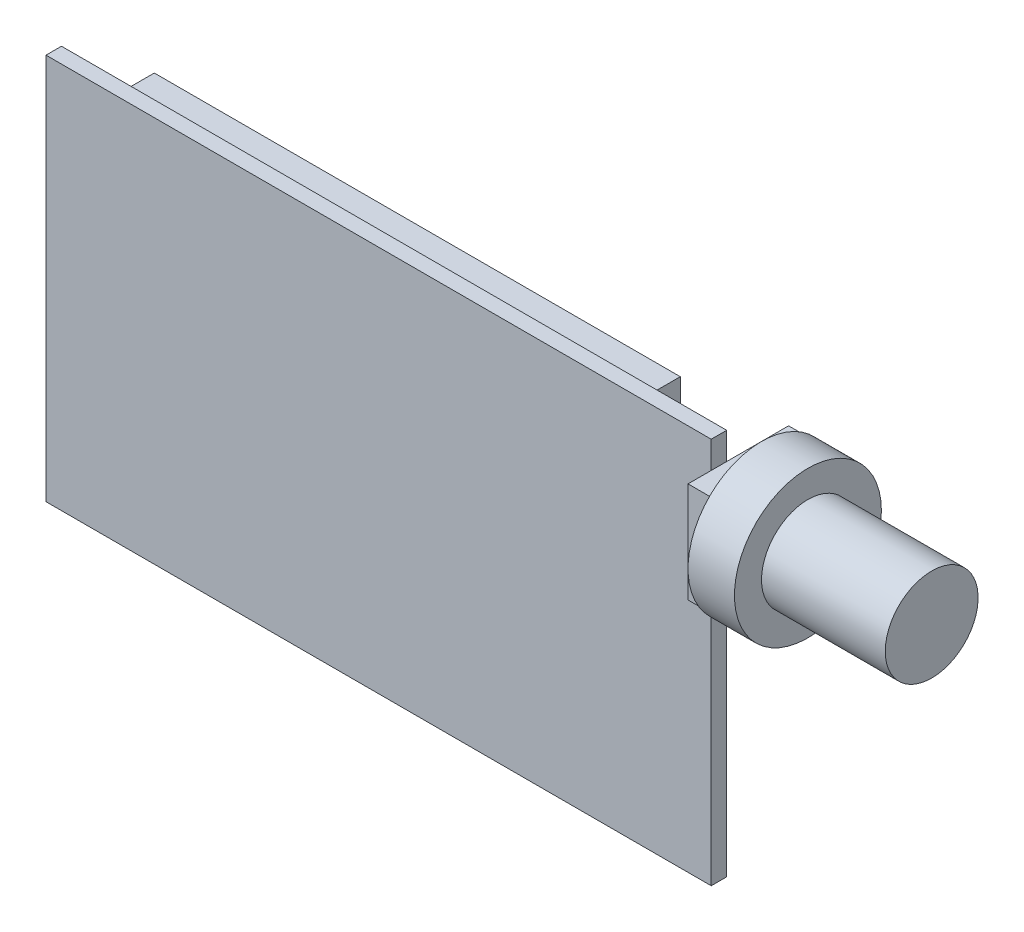
from build123d import *

# Parameters (mm, degrees)
SKETCH_1_W      = 43
SKETCH_1_H      = 25
EXTRUDE_1_DEPTH = 1
SKETCH_3_W      = 34
SKETCH_3_H      = 22
EXTRUDE_2_DEPTH = 4
SKETCH_4_W      = 6.5
SKETCH_4_H      = 6.5
EXTRUDE_3_DEPTH = 1.5
SKETCH_5_R      = 3
EXTRUDE_4_DEPTH = 12.5
SKETCH_6_R      = 4.75
EXTRUDE_5_DEPTH = 3


with BuildPart() as part:
    # 草图1 → 凸台-拉伸1 (new body)
    with BuildSketch(Plane.XY):
        Rectangle(SKETCH_1_W, SKETCH_1_H)
    extrude(amount=-EXTRUDE_1_DEPTH)

    # 草图3 → 凸台-拉伸2 (add)
    with BuildSketch(Plane.XY):
        with Locations((-1.5, 0)):
            Rectangle(SKETCH_3_W, SKETCH_3_H)
    extrude(amount=-EXTRUDE_2_DEPTH)

    # 草图4 → 凸台-拉伸3 (add)
    with BuildSketch(Plane(origin=(21.5, 0, 0), x_dir=(0, 0, -1), z_dir=(1, 0, 0))):
        with Locations((1.75, 7.5)):
            Rectangle(SKETCH_4_W, SKETCH_4_H)
    extrude(amount=EXTRUDE_3_DEPTH)

    # 草图5 → 凸台-拉伸4 (add)
    with BuildSketch(Plane.ZY.offset(-21.5)):
        with Locations((-1.75, 7.5)):
            Circle(SKETCH_5_R)
    extrude(amount=-EXTRUDE_4_DEPTH)

    # 草图6 → 凸台-拉伸5 (add)
    with BuildSketch(Plane(origin=(23, 0, 0), x_dir=(0, 0, -1), z_dir=(1, 0, 0))):
        with Locations((1.75, 7.5)):
            Circle(SKETCH_6_R)
    extrude(amount=EXTRUDE_5_DEPTH)


solid = part.part
